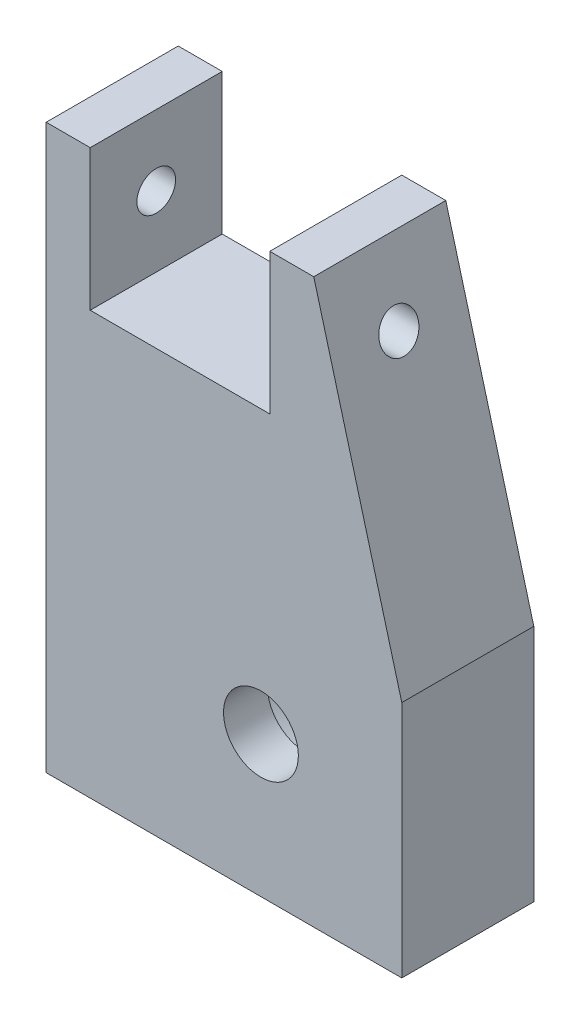
from build123d import *

# Parameters (mm, degrees)
SZKIC1_R                    = 11.1
DODANIE_WYCI_GNI_CIE1_DEPTH = 15
DODANIE_WYCI_GNI_CIE2_START = -5
SZKIC2_R                    = 11.1
SZKIC2_R_2                  = 4.25
DODANIE_WYCI_GNI_CIE2_DEPTH = 5
SZKIC3_R                    = 2.2
WYTNIJ_WYCI_GNI_CIE1_DEPTH  = 71.662295462


with BuildPart() as part:
    # Szkic1 → Dodanie-wyciągnięcie1 (new body)
    with BuildSketch(Plane.XY):
        Polygon((25.2, -56), (25.2, -28.9), (15.2, 8), (10.2, 8), (10.2, -8), (-10.2, -8), (-10.2, 8), (-15.2, 8), (-15.2, -56), align=None)
        with Locations((9.2, -40)):
            Circle(SZKIC1_R, mode=Mode.SUBTRACT)
    extrude(amount=DODANIE_WYCI_GNI_CIE1_DEPTH)

    # Szkic2 → Dodanie-wyciągnięcie2 (add)
    with BuildSketch(Plane.XY.offset(15).offset(DODANIE_WYCI_GNI_CIE2_START)):
        with Locations((9.2, -40)):
            Circle(SZKIC2_R)
        with Locations((9.2, -40)):
            Circle(SZKIC2_R_2, mode=Mode.SUBTRACT)
    extrude(amount=DODANIE_WYCI_GNI_CIE2_DEPTH)

    # Szkic3 → Wytnij-wyciągnięcie1 (cut, through all)
    with BuildSketch(Plane.ZY.offset(15.2)):
        with Locations(Location((7.5, 0, 0), (0, 0, 270))):
            Circle(SZKIC3_R)
    extrude(amount=-WYTNIJ_WYCI_GNI_CIE1_DEPTH, mode=Mode.SUBTRACT)


solid = part.part
